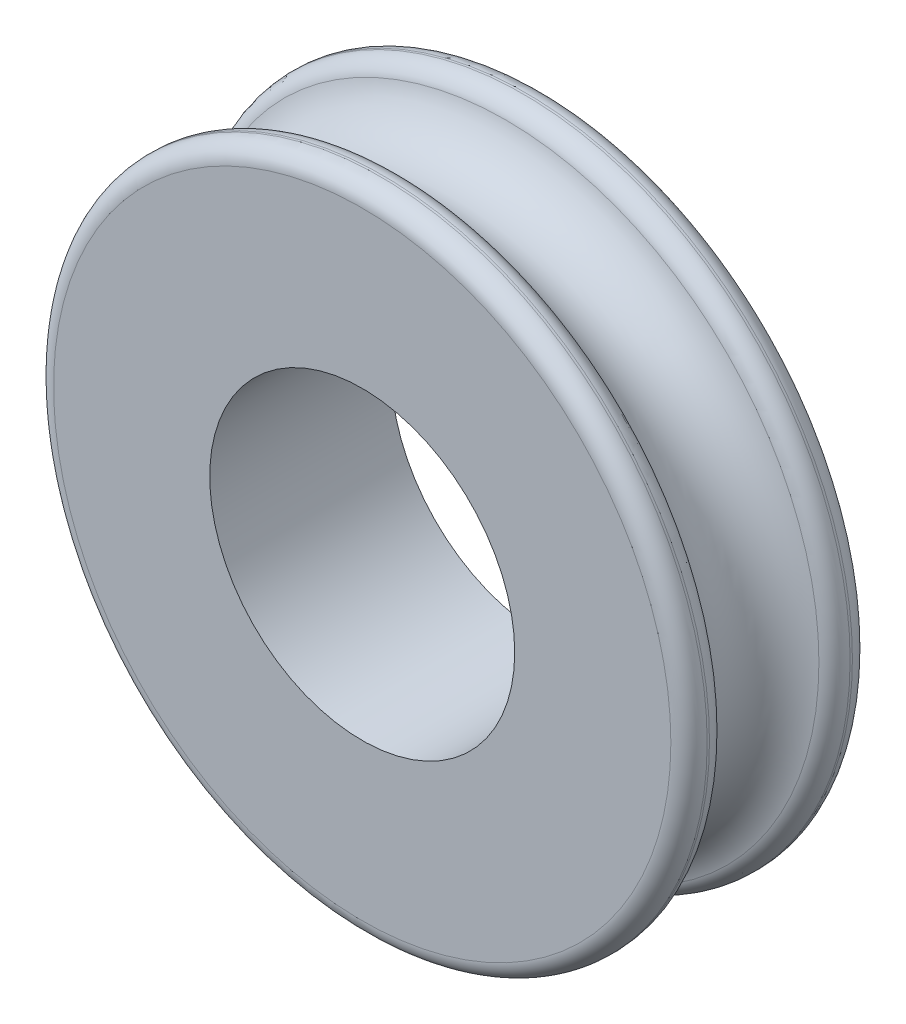
from build123d import *

# Parameters (mm, degrees)
SKETCH_1_R      = 9
SKETCH_1_R_2    = 4.2
EXTRUDE_1_DEPTH = 2.5
SKETCH_3_R      = 1.5
FILLET_1_R      = 0.5
FILLET_2_R      = 0.5


with BuildPart() as part:
    # Эскиз1 → Бобышка-Вытянуть1 (new, symmetric)
    with BuildSketch(Plane.XY):
        Circle(SKETCH_1_R)
        Circle(SKETCH_1_R_2, mode=Mode.SUBTRACT)
    extrude(amount=EXTRUDE_1_DEPTH, both=True)

    # Вырез-По траектории1: sweep along a path in Эскиз4
    with BuildLine(Plane.XY) as sweep_1_path:
        CenterArc((0, 0), 9, 0, 360)
    # Эскиз3 → Вырез-По траектории1 (sweep, cut)
    with BuildSketch(Plane(origin=(0, 0, 0), x_dir=(1, 0, 0), z_dir=(0, 1, 0))):
        with Locations((9, 0)):
            Circle(SKETCH_3_R)
    sweep(path=sweep_1_path.line, mode=Mode.SUBTRACT)

    # Скругление1
    fillet_1_edges = [part.edges().sort_by_distance(p)[0] for p in [
        (-9, 0, -2.5),
        (-9, 0, 2.5),
    ]]
    fillet(fillet_1_edges, radius=FILLET_1_R)

    # Скругление2
    fillet_2_edges = [part.edges().sort_by_distance(p)[0] for p in [
        (-9, 0, 1.5),
        (-9, 0, -1.5),
    ]]
    fillet(fillet_2_edges, radius=FILLET_2_R)


solid = part.part
